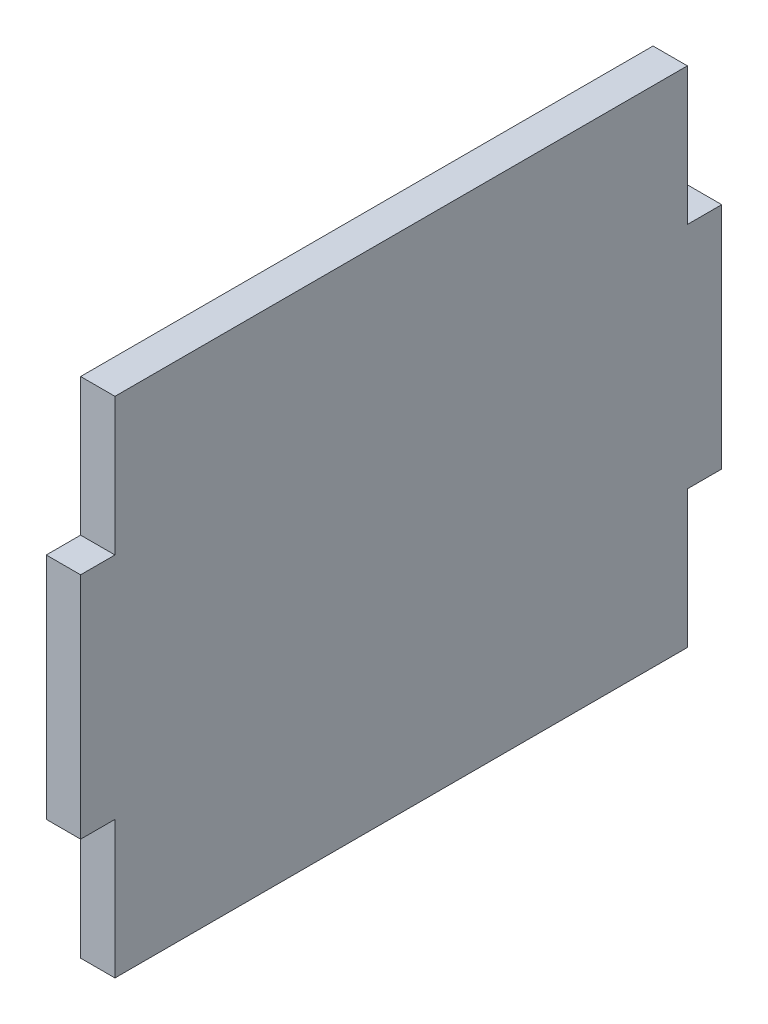
from build123d import *

# Parameters (mm, degrees)
BOSS_EXTRUDE1_DEPTH = 3


with BuildPart() as part:
    # Sketch1 → Boss-Extrude1 (new body)
    with BuildSketch(Plane(origin=(0, 0, 0), x_dir=(0, 0, -1), z_dir=(1, 0, 0))):
        Polygon((0, 0), (50, 0), (50, 12), (53, 12), (53, 32), (50, 32), (50, 44), (0, 44), (0, 32), (-3, 32), (-3, 12), (0, 12), align=None)
    extrude(amount=BOSS_EXTRUDE1_DEPTH)


solid = part.part
